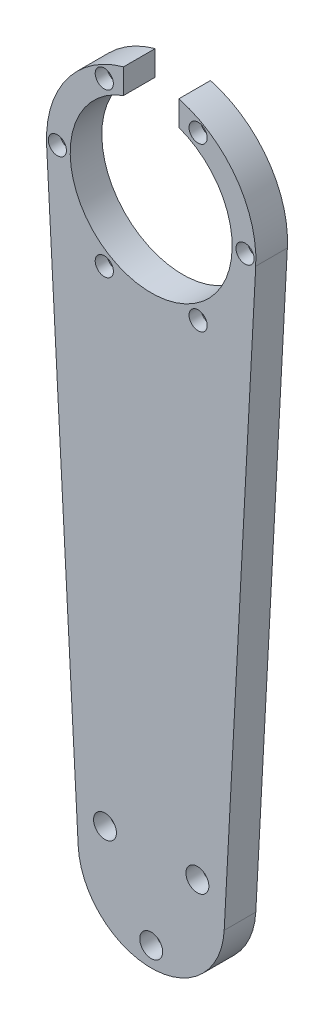
from build123d import *

# Parameters (mm, degrees)
BOSS_EXTRUDE1_DEPTH = 8
SKETCH7_R           = 1.6
CUT_EXTRUDE2_DEPTH  = 8
SKETCH12_R          = 1.25
CUT_EXTRUDE6_DEPTH  = 10
SKETCH13_R          = 2.9
CUT_EXTRUDE7_DEPTH  = 4
SKETCH14_R          = 2.3
CUT_EXTRUDE8_DEPTH  = 3


with BuildPart() as part:
    # Sketch4 → Boss-Extrude1 (new body)
    with BuildSketch(Plane.XY):
        with BuildLine():
            Line((-26.462284272, 148.586666667), (-18.473670152, -0.986666667))
            ThreePointArc((-18.473670152, -0.986666667), (0, -18.5), (18.473670152, -0.986666667))
            Line((18.473670152, -0.986666667), (26.462284272, 148.586666667))
            ThreePointArc((26.462284272, 148.586666667), (21.489637404, 165.506304662), (7, 175.558755838))
            Line((7, 175.558755838), (7, 169.267848868))
            ThreePointArc((7, 169.267848868), (0, 129.5), (-7, 169.267848868))
            Line((-7, 169.267848868), (-7, 175.558755838))
            ThreePointArc((-7, 175.558755838), (-21.489637404, 165.506304662), (-26.462284272, 148.586666667))
        make_face()
    extrude(amount=BOSS_EXTRUDE1_DEPTH)

    # Sketch7 → Cut-Extrude2 (cut)
    with BuildSketch(Plane.XY.offset(8)):
        with Locations((0, -13.5)):
            Circle(SKETCH7_R)
        with Locations((-11.691342951, 6.75)):
            Circle(SKETCH7_R)
        with Locations((11.691342951, 6.75)):
            Circle(SKETCH7_R)
    extrude(amount=-CUT_EXTRUDE2_DEPTH, mode=Mode.SUBTRACT)

    # Sketch12 → Cut-Extrude6 (cut)
    with BuildSketch(Plane.XY.offset(8)):
        with Locations((23.75, 150)):
            Circle(SKETCH12_R)
        with Locations((11.875, 129.43189666)):
            Circle(SKETCH12_R)
        with Locations((-11.875, 129.43189666)):
            Circle(SKETCH12_R)
        with Locations((-23.75, 150)):
            Circle(SKETCH12_R)
        with Locations((-11.875, 170.56810334)):
            Circle(SKETCH12_R)
        with Locations((11.875, 170.56810334)):
            Circle(SKETCH12_R)
    extrude(amount=-CUT_EXTRUDE6_DEPTH, mode=Mode.SUBTRACT)

    # Sketch13 → Cut-Extrude7 (cut)
    with BuildSketch(Plane.XY.offset(8)):
        with Locations((-11.691342951, 6.75)):
            Circle(SKETCH13_R)
        with Locations((11.691342951, 6.75)):
            Circle(SKETCH13_R)
        with Locations((0, -13.5)):
            Circle(SKETCH13_R)
    extrude(amount=-CUT_EXTRUDE7_DEPTH, mode=Mode.SUBTRACT)

    # Sketch14 → Cut-Extrude8 (cut)
    with BuildSketch(Plane.XY.offset(8)):
        with Locations((23.75, 150)):
            Circle(SKETCH14_R)
        with Locations((11.875, 129.43189666)):
            Circle(SKETCH14_R)
        with Locations((-11.875, 129.43189666)):
            Circle(SKETCH14_R)
        with Locations((-23.75, 150)):
            Circle(SKETCH14_R)
        with Locations((-11.875, 170.56810334)):
            Circle(SKETCH14_R)
        with Locations((11.875, 170.56810334)):
            Circle(SKETCH14_R)
    extrude(amount=-CUT_EXTRUDE8_DEPTH, mode=Mode.SUBTRACT)


solid = part.part
